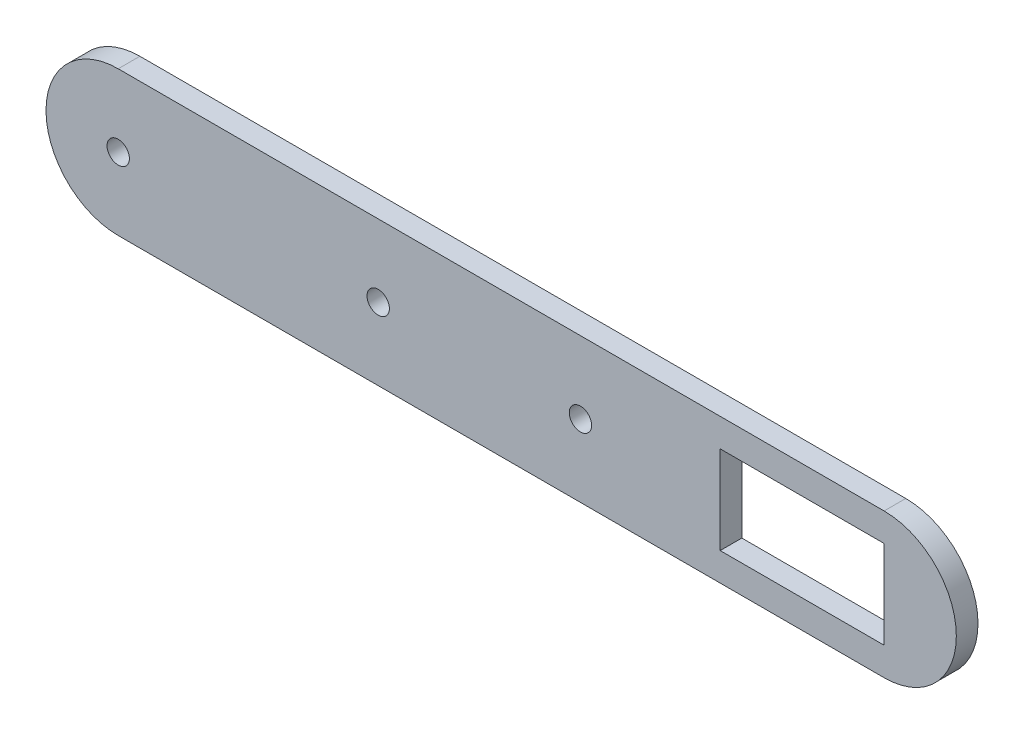
from build123d import *

# Parameters (mm, degrees)
BOSS_EXTRUDE1_DEPTH = 3
SKETCH3_R           = 1.55
CUT_EXTRUDE2_DEPTH  = 3
SKETCH4_R           = 1.55
CUT_EXTRUDE4_DEPTH  = 3
SKETCH5_R           = 1.55
CUT_EXTRUDE6_DEPTH  = 3
SKETCH6_W           = 22.7
SKETCH6_H           = 12.2
CUT_EXTRUDE7_DEPTH  = 3


with BuildPart() as part:
    # Sketch1 → Boss-Extrude1 (new body)
    with BuildSketch(Plane.XY):
        with BuildLine():
            Line((-58.058617241, 24.191090517), (47.991382759, 24.191090517))
            ThreePointArc((47.991382759, 24.191090517), (57.991382759, 14.191090517), (47.991382759, 4.191090517))
            Line((47.991382759, 4.191090517), (-58.058617241, 4.191090517))
            ThreePointArc((-58.058617241, 4.191090517), (-68.058617241, 14.191090517), (-58.058617241, 24.191090517))
        make_face()
    extrude(amount=BOSS_EXTRUDE1_DEPTH)

    # Sketch3 → Cut-Extrude2 (cut)
    with BuildSketch(Plane.XY.offset(3)):
        with Locations((-58.058617241, 14.191090517)):
            Circle(SKETCH3_R)
    extrude(amount=-CUT_EXTRUDE2_DEPTH, mode=Mode.SUBTRACT)

    # Sketch4 → Cut-Extrude4 (cut)
    with BuildSketch(Plane(origin=(9.979459273, 1.433252018, 3), x_dir=(1, 0, 0), z_dir=(0, 0, 1))):
        with Locations((-4.038076514, 12.757838499)):
            Circle(SKETCH4_R)
    extrude(amount=-CUT_EXTRUDE4_DEPTH, mode=Mode.SUBTRACT)

    # Sketch5 → Cut-Extrude6 (cut)
    with BuildSketch(Plane(origin=(-9.979459273, 1.433252018, 0), x_dir=(-1, 0, 0), z_dir=(0, 0, -1))):
        with Locations((12.079157968, 12.757838499)):
            Circle(SKETCH5_R)
    extrude(amount=-CUT_EXTRUDE6_DEPTH, mode=Mode.SUBTRACT)

    # Sketch6 → Cut-Extrude7 (cut)
    with BuildSketch(Plane.XY.offset(3)):
        with Locations((36.641382759, 14.191090517)):
            Rectangle(SKETCH6_W, SKETCH6_H)
    extrude(amount=-CUT_EXTRUDE7_DEPTH, mode=Mode.SUBTRACT)


solid = part.part
